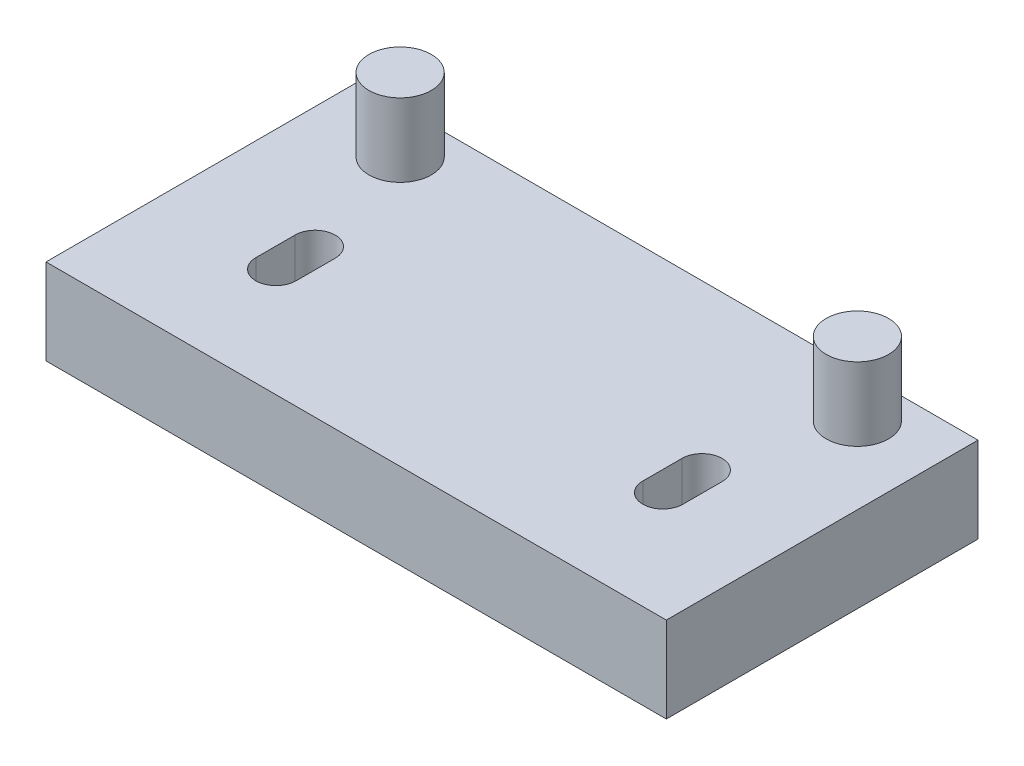
from build123d import *

# Parameters (mm, degrees)
SKETCH1_W           = 301.378206246
SKETCH1_H           = 151.435088782
BOSS_EXTRUDE1_DEPTH = 41.656
CUT_EXTRUDE1_DEPTH  = 214.376
SKETCH3_R           = 15.161110792
BOSS_EXTRUDE2_DEPTH = 35.56


with BuildPart() as part:
    # Sketch1 → Boss-Extrude1 (new body)
    with BuildSketch(Plane(origin=(0, 0, 0), x_dir=(1, 0, 0), z_dir=(0, 1, 0))):
        with Locations((-2.237956977, 0)):
            Rectangle(SKETCH1_W, SKETCH1_H)
    extrude(amount=BOSS_EXTRUDE1_DEPTH)

    # Sketch2 → Cut-Extrude1 (cut)
    with BuildSketch(Plane(origin=(0, 41.656, 0), x_dir=(1, 0, 0), z_dir=(0, 1, 0))):
        with BuildLine():
            Line((-103.753069352, -3.904427399), (-103.753069352, -22.938510969))
            ThreePointArc((-103.753069352, -22.938510969), (-93.992000854, -32.699579467), (-84.230932357, -22.938510969))
            Line((-84.230932357, -22.938510969), (-84.230932357, -3.904427399))
            ThreePointArc((-84.230932357, -3.904427399), (-93.992000854, 5.856641099), (-103.753069352, -3.904427399))
        make_face()
    cut_extrude1 = extrude(amount=-CUT_EXTRUDE1_DEPTH, mode=Mode.SUBTRACT)

    # Sketch3 → Boss-Extrude2 (add)
    with BuildSketch(Plane(origin=(0, 41.656, 0), x_dir=(1, 0, 0), z_dir=(0, 1, 0))):
        with Locations(Location((-111.073870725, 54.487556638, 0), (0, 0, 270))):
            Circle(SKETCH3_R)
    boss_extrude2 = extrude(amount=BOSS_EXTRUDE2_DEPTH)

    # Mirror1: Cut-Extrude1, Boss-Extrude2 across plane
    add(cut_extrude1.mirror(Plane(origin=(0, 0, 0), x_dir=(0, 0, 1), z_dir=(1, 0, 0))), mode=Mode.SUBTRACT)
    add(boss_extrude2.mirror(Plane(origin=(0, 0, 0), x_dir=(0, 0, 1), z_dir=(1, 0, 0))))


solid = part.part
